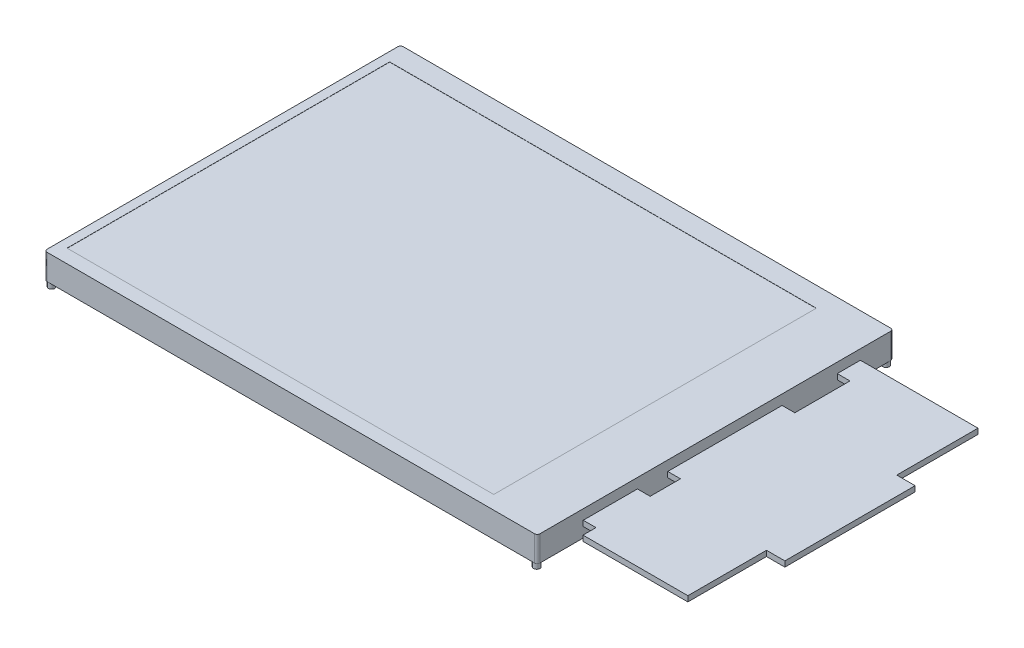
from build123d import *

# Parameters (mm, degrees)
SKETCH1_W           = 69.0372
SKETCH1_H           = 49.8856
BOSS_EXTRUDE1_DEPTH = 1.778
FILLET1_R           = 0.381
SKETCH2_W           = 59.7662
SKETCH2_H           = 45.1866
CUT_EXTRUDE1_DEPTH  = 0.0254
SKETCH3_R           = 0.4445
BOSS_EXTRUDE2_DEPTH = 0.762
SKETCH5_W           = 19.05
SKETCH5_H           = 40.64
BOSS_EXTRUDE3_DEPTH = 0.381
SKETCH6_W           = 2.571951578
SKETCH6_H           = 11.383775042
SKETCH6_H_2         = 11.011674943
SKETCH6_W_2         = 1.784918448
SKETCH6_H_3         = 1.819764249
SKETCH6_H_4         = 4.247776912
SKETCH6_H_5         = 7.729561266
CUT_EXTRUDE2_DEPTH  = 60.163083243


with BuildPart() as part:
    # Sketch1 → Boss-Extrude1 (new, symmetric)
    with BuildSketch(Plane(origin=(0, 0, 0), x_dir=(1, 0, 0), z_dir=(0, 1, 0))):
        Rectangle(SKETCH1_W, SKETCH1_H)
    extrude(amount=BOSS_EXTRUDE1_DEPTH, both=True)

    # Fillet1
    fillet1_edges = [part.edges().sort_by_distance(p)[0] for p in [
        (34.5186, 0, 24.9428),
        (-34.5186, 0, 24.9428),
        (-34.5186, 0, -24.9428),
        (34.5186, 0, -24.9428),
    ]]
    fillet(fillet1_edges, radius=FILLET1_R)

    # Sketch2 → Cut-Extrude1 (cut)
    with BuildSketch(Plane(origin=(0, 1.778, 0), x_dir=(1, 0, 0), z_dir=(0, 1, 0))):
        with Locations((-3.3655, -0.4445)):
            Rectangle(SKETCH2_W, SKETCH2_H)
    extrude(amount=-CUT_EXTRUDE1_DEPTH, mode=Mode.SUBTRACT)

    # Sketch3 → Boss-Extrude2 (add)
    with BuildSketch(Plane.XZ.offset(1.778)):
        with Locations(Location((-33.9725, 24.4729, 0), (0, 0, 270))):
            Circle(SKETCH3_R)
        with Locations(Location((33.9725, 24.4729, 0), (0, 0, 270))):
            Circle(SKETCH3_R)
        with Locations(Location((33.9725, -24.4729, 0), (0, 0, 270))):
            Circle(SKETCH3_R)
        with Locations(Location((-33.9725, -24.4729, 0), (0, 0, 270))):
            Circle(SKETCH3_R)
    extrude(amount=BOSS_EXTRUDE2_DEPTH)

    # Sketch5 → Boss-Extrude3 (add, symmetric)
    with BuildSketch(Plane(origin=(0, 0, 0), x_dir=(1, 0, 0), z_dir=(0, 1, 0))):
        with Locations((44.0436, 0)):
            Rectangle(SKETCH5_W, SKETCH5_H)
    extrude(amount=BOSS_EXTRUDE3_DEPTH, both=True)

    # Sketch6 → Cut-Extrude2 (cut, through all)
    with BuildSketch(Plane(origin=(0, 0.381, 0), x_dir=(1, 0, 0), z_dir=(0, 1, 0))):
        with Locations((52.282624211, 14.628112479)):
            Rectangle(SKETCH6_W, SKETCH6_H)
        with Locations((52.282624211, -14.814162529)):
            Rectangle(SKETCH6_W, SKETCH6_H_2)
        with Locations((35.411059224, -19.410117875)):
            Rectangle(SKETCH6_W_2, SKETCH6_H_3)
        with Locations((35.411059224, -8.786057404)):
            Rectangle(SKETCH6_W_2, SKETCH6_H_4)
        with Locations((35.411059224, 13.218819714)):
            Rectangle(SKETCH6_W_2, SKETCH6_H_5)
    extrude(amount=-CUT_EXTRUDE2_DEPTH, mode=Mode.SUBTRACT)


solid = part.part
